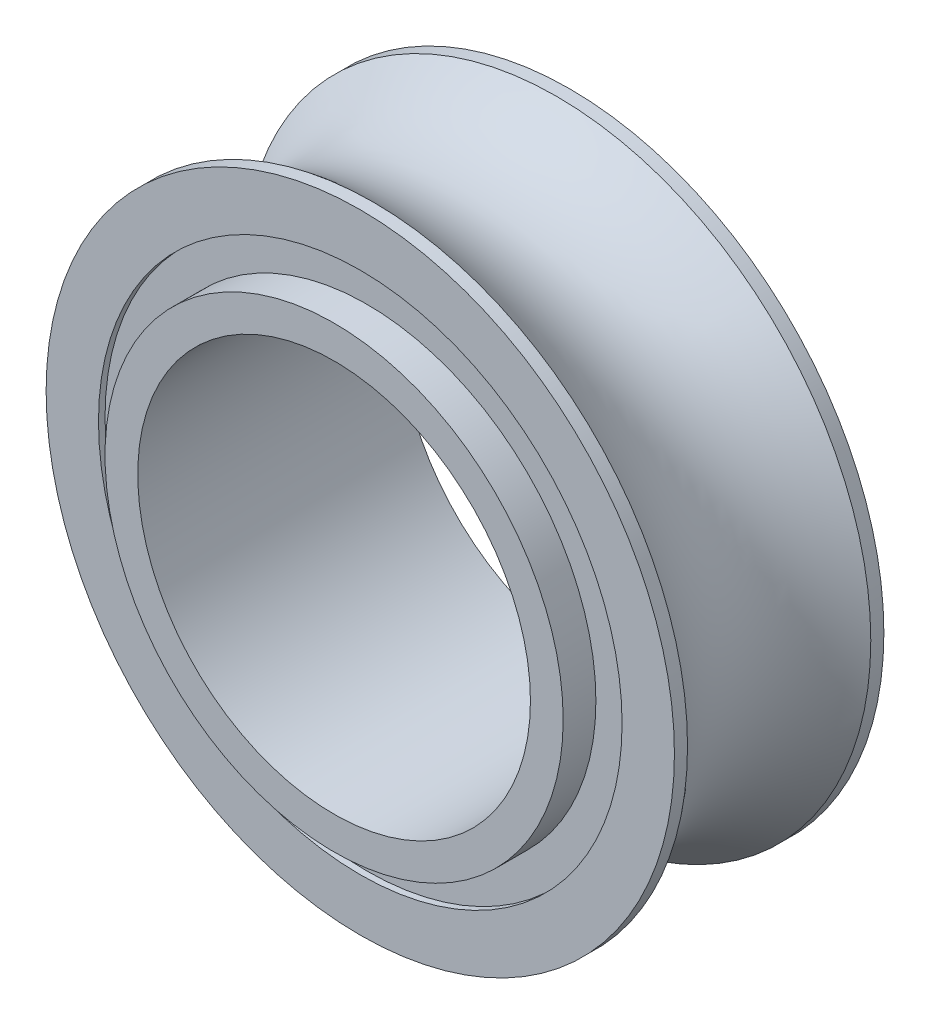
from build123d import *

# Parameters (mm, degrees)
SKETCH1_R           = 22.225
SKETCH1_R_2         = 19.05
BOSS_EXTRUDE1_DEPTH = 12.7
SKETCH2_R           = 25.4
SKETCH2_R_2         = 22.225
BOSS_EXTRUDE2_DEPTH = 9.525
SKETCH3_R           = 30.48
SKETCH3_R_2         = 25.4
BOSS_EXTRUDE3_DEPTH = 10.16


with BuildPart() as part:
    # Sketch1 → Boss-Extrude1 (new, symmetric)
    with BuildSketch(Plane.XY):
        Circle(SKETCH1_R)
        Circle(SKETCH1_R_2, mode=Mode.SUBTRACT)
    extrude(amount=BOSS_EXTRUDE1_DEPTH, both=True)

    # Sketch2 → Boss-Extrude2 (add, symmetric)
    with BuildSketch(Plane.XY):
        with Locations(Location((0, 0, 0), (0, 0, 180))):
            Circle(SKETCH2_R)
        Circle(SKETCH2_R_2, mode=Mode.SUBTRACT)
    extrude(amount=BOSS_EXTRUDE2_DEPTH, both=True)

    # Sketch3 → Boss-Extrude3 (add, symmetric)
    with BuildSketch(Plane.XY):
        Circle(SKETCH3_R)
        Circle(SKETCH3_R_2, mode=Mode.SUBTRACT)
    extrude(amount=BOSS_EXTRUDE3_DEPTH, both=True)

    # Sketch4 → Cut-Revolve2 (revolve, cut)
    with BuildSketch(Plane(origin=(0, 0, 0), x_dir=(0, 0, -1), z_dir=(1, 0, 0)), mode=Mode.PRIVATE) as cut_revolve2_sk:
        with BuildLine():
            Line((-8.89, 30.48), (8.89, 30.48))
            add(Edge.make_bspline(
                [(-8.89, 30.48), (0, 22.86), (8.89, 30.48)],
                knots=[0, 0, 0, 1, 1, 1], degree=2))
        make_face()
    revolve(cut_revolve2_sk.sketch.rotate(Axis((0, 0, 0), (0, 0, -1)), 90), axis=Axis((0, 0, 0), (0, 0, -1)), mode=Mode.SUBTRACT)


solid = part.part
